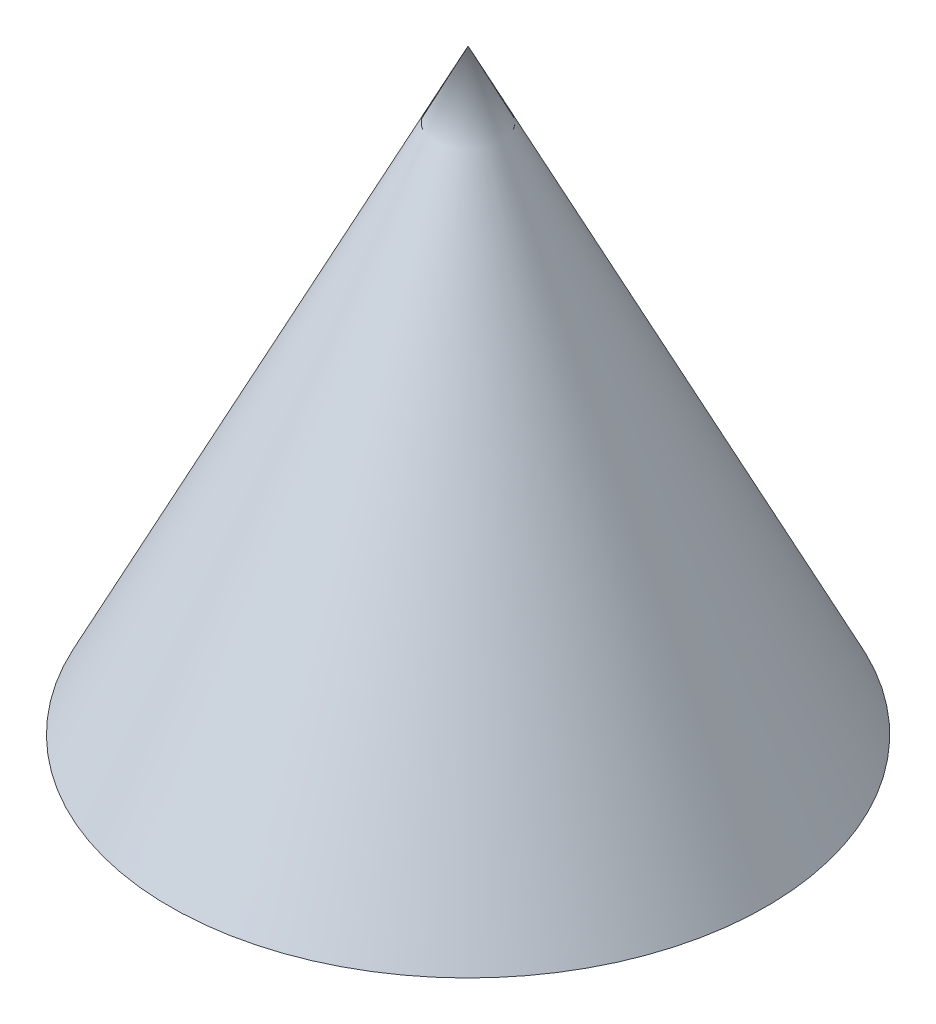
from build123d import *


with BuildPart() as part:
    # Sketch1 → Revolve1 (revolve)
    with BuildSketch(Plane.XY, mode=Mode.PRIVATE) as revolve1_sk:
        Polygon((0, 0), (5, 0), (0, 10), align=None)
    revolve(revolve1_sk.sketch.rotate(Axis((0, 0, 0), (0, 1, 0)), 90), axis=Axis((0, 0, 0), (0, 1, 0)))


solid = part.part
